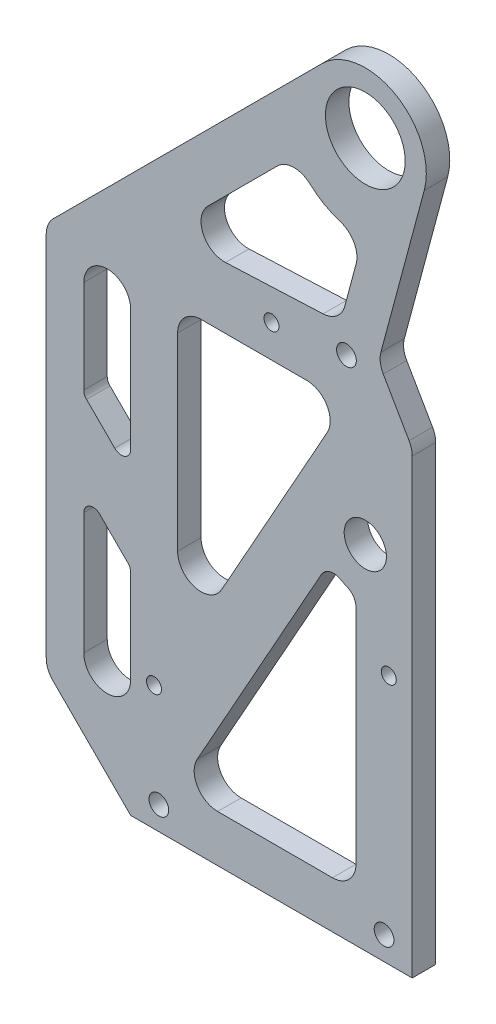
from build123d import *

# Parameters (mm, degrees)
SKETCH1_W           = 80
SKETCH1_H           = 180
SKETCH1_R           = 8.5
BOSS_EXTRUDE1_DEPTH = 5
SKETCH2_R           = 4.5
CUT_EXTRUDE1_DEPTH  = 30
SKETCH3_R           = 1.6
SKETCH3_R_2         = 2.5
CUT_EXTRUDE2_DEPTH  = 5
CUT_EXTRUDE3_DEPTH  = 10
BOSS_EXTRUDE2_DEPTH = 5
FILLET1_R           = 2
FILLET2_R           = 5
SKETCH6_R           = 2.1
CUT_EXTRUDE4_DEPTH  = 5
SKETCH7_W           = 60
SKETCH7_H           = 19.778044947
BOSS_EXTRUDE3_DEPTH = 5
SKETCH8_R           = 2.1
CUT_EXTRUDE6_DEPTH  = 5
CUT_EXTRUDE7_DEPTH  = 5
CUT_EXTRUDE8_DEPTH  = 10
FILLET3_R           = 5
FILLET4_R           = 3


with BuildPart() as part:
    # Sketch1 → Boss-Extrude1 (new body)
    with BuildSketch(Plane.XY):
        with Locations((10, 166)):
            Rectangle(SKETCH1_W, SKETCH1_H)
        with Locations((20, 226)):
            Circle(SKETCH1_R, mode=Mode.SUBTRACT)
    extrude(amount=BOSS_EXTRUDE1_DEPTH)

    # Sketch2 → Cut-Extrude1 (cut)
    with BuildSketch(Plane.XY.offset(5)):
        with Locations((20, 151)):
            Circle(SKETCH2_R)
    extrude(amount=-CUT_EXTRUDE1_DEPTH, mode=Mode.SUBTRACT)

    # Sketch3 → Cut-Extrude2 (cut)
    with BuildSketch(Plane.XY.offset(5)):
        with Locations((0, 182)):
            Circle(SKETCH3_R)
        with Locations((25, 129.301270189)):
            Circle(SKETCH3_R)
        with Locations((-25.032859693, 102.533479235)):
            Circle(SKETCH3_R)
        with Locations((-15, 81)):
            Circle(SKETCH3_R_2)
        with Locations((15, 81)):
            Circle(SKETCH3_R_2)
        with Locations((24, 91)):
            Circle(SKETCH3_R_2)
        with Locations((-24, 91)):
            Circle(SKETCH3_R_2)
    extrude(amount=-CUT_EXTRUDE2_DEPTH, mode=Mode.SUBTRACT)

    # Sketch4 → Cut-Extrude3 (cut)
    with BuildSketch(Plane.XY.offset(5)):
        with BuildLine():
            Line((-30, 194.384776311), (10.807611845, 235.192388155))
            ThreePointArc((10.807611845, 235.192388155), (24.974884621, 238.010433923), (33, 226))
            ThreePointArc((33, 226), (32.888783198, 224.303159501), (32.557035742, 222.635352414))
            Line((32.557035742, 222.635352414), (22.786943589, 186.172872106))
            Line((22.786943589, 186.172872106), (30, 173.679491924))
            Line((30, 173.679491924), (30, 76))
            Line((30, 76), (50, 76))
            Line((50, 76), (50, 256))
            Line((50, 256), (-30, 256))
            Line((-30, 256), (-30, 194.384776311))
        make_face()
    extrude(amount=-CUT_EXTRUDE3_DEPTH, mode=Mode.SUBTRACT)

    # Sketch5 → Boss-Extrude2 (add)
    with BuildSketch(Plane.XY.offset(5)):
        with BuildLine():
            Line((-30, 169.384776311), (-30, 194.384776311))
            Line((-30, 194.384776311), (-46.535533906, 177.849242405))
            ThreePointArc((-46.535533906, 177.849242405), (-47.619397663, 176.227125661), (-48, 174.313708499))
            Line((-48, 174.313708499), (-48, 96.071067812))
            ThreePointArc((-48, 96.071067812), (-47.619397663, 94.15765065), (-46.535533906, 92.535533906))
            Line((-46.535533906, 92.535533906), (-30, 76))
            Line((-30, 76), (-30, 101))
            ThreePointArc((-30, 101), (-35, 96), (-40, 101))
            Line((-40, 101), (-40, 131.707106781))
            Line((-40, 131.707106781), (-30, 121.707106781))
            Line((-30, 121.707106781), (-30, 138.67766953))
            Line((-30, 138.67766953), (-40, 148.67766953))
            Line((-40, 148.67766953), (-40, 169.384776311))
            ThreePointArc((-40, 169.384776311), (-35, 174.384776311), (-30, 169.384776311))
        make_face()
    extrude(amount=-BOSS_EXTRUDE2_DEPTH)

    # Fillet1
    fillet1_edges = [part.edges().sort_by_distance(p)[0] for p in [
        (-30, 121.707106781, 2.5),
        (-40, 131.707106781, 2.5),
        (-40, 148.67766953, 2.5),
        (-30, 138.67766953, 2.5),
    ]]
    fillet(fillet1_edges, radius=FILLET1_R)

    # Fillet2
    fillet2_edges = [part.edges().sort_by_distance(p)[0] for p in [
        (30, 173.679491924, 2.5),
        (22.786943589, 186.172872106, 2.5),
    ]]
    fillet(fillet2_edges, radius=FILLET2_R)

    # Sketch6 → Cut-Extrude4 (cut)
    with BuildSketch(Plane.XY.offset(5)):
        with Locations((15.982125076, 183.959163508)):
            Circle(SKETCH6_R)
    extrude(amount=-CUT_EXTRUDE4_DEPTH, mode=Mode.SUBTRACT)

    # Sketch7 → Boss-Extrude3 (add)
    with BuildSketch(Plane.XY.offset(5)):
        with Locations((0, 85.889022474)):
            Rectangle(SKETCH7_W, SKETCH7_H)
    extrude(amount=-BOSS_EXTRUDE3_DEPTH)

    # Sketch8 → Cut-Extrude6 (cut)
    with BuildSketch(Plane.XY.offset(5)):
        with Locations((-24, 81)):
            Circle(SKETCH8_R)
        with Locations((24, 81)):
            Circle(SKETCH8_R)
    extrude(amount=-CUT_EXTRUDE6_DEPTH, mode=Mode.SUBTRACT)

    # Sketch9 → Cut-Extrude7 (cut)
    with BuildSketch(Plane.XY.offset(5)):
        with BuildLine():
            Line((18.046029168, 201.838654795), (15.618513493, 192.779042959))
            ThreePointArc((15.618513493, 192.779042959), (13.91917225, 190.174254019), (11.008699323, 189.077972384))
            Line((11.008699323, 189.077972384), (-9.794056189, 188.162535924))
            ThreePointArc((-9.794056189, 188.162535924), (-14.590082182, 191.143181287), (-13.549405056, 196.693235631))
            Line((-13.549405056, 196.693235631), (1.27739155, 211.520032237))
            ThreePointArc((1.27739155, 211.520032237), (4.701786886, 212.983263), (8.18783091, 211.673673466))
            ThreePointArc((8.18783091, 211.673673466), (11.25, 209.430341871), (14.723866695, 207.900091446))
            ThreePointArc((14.723866695, 207.900091446), (17.601026512, 205.53588353), (18.046029168, 201.838654795))
        make_face()
    extrude(amount=-CUT_EXTRUDE7_DEPTH, mode=Mode.SUBTRACT)

    # Sketch10 → Cut-Extrude8 (cut)
    with BuildSketch(Plane.XY.offset(5)):
        Polygon((-20, 175.052757164), (-20, 110.591633523), (16.036879799, 175.052757164), align=None)
        with BuildLine():
            Line((12.329553187, 143.829627228), (-20, 86))
            Line((-20, 86), (18, 86))
            Line((18, 86), (18, 140.692235936))
            ThreePointArc((18, 140.692235936), (14.916675161, 141.812518921), (12.329553187, 143.829627228))
        make_face()
    extrude(amount=-CUT_EXTRUDE8_DEPTH, mode=Mode.SUBTRACT)

    # Fillet3
    fillet3_edges = [part.edges().sort_by_distance(p)[0] for p in [
        (18, 86, 2.5),
        (-20, 86, 2.5),
        (-20, 175.052757164, 2.5),
        (16.036879799, 175.052757164, 2.5),
        (-20, 110.591633523, 2.5),
    ]]
    fillet(fillet3_edges, radius=FILLET3_R)

    # Fillet4
    fillet4_edges = [part.edges().sort_by_distance(p)[0] for p in [
        (12.329553187, 143.829627228, 2.5),
        (18, 140.692235936, 2.5),
    ]]
    fillet(fillet4_edges, radius=FILLET4_R)


solid = part.part
